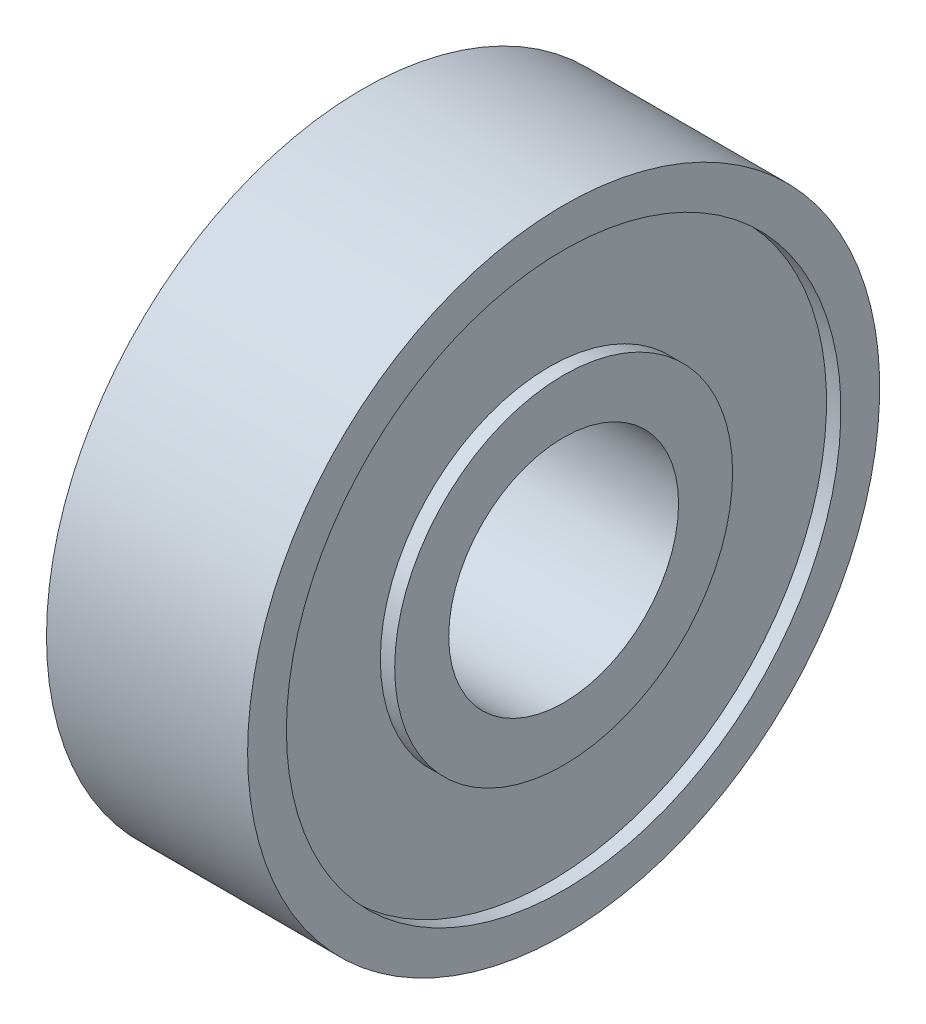
from build123d import *


with BuildPart() as part:
    # Sketch2 → Revolve2 (revolve)
    with BuildSketch(Plane(origin=(0, 0, 0), x_dir=(1, 0, 0), z_dir=(0, 1, 0)), mode=Mode.PRIVATE) as revolve2_sk:
        Polygon((3, 9.65), (3.5, 9.65), (3.5, 11), (-3.5, 11), (-3.5, 9.65), (-3, 9.65), (-3, 5.88), (-3.5, 5.88), (-3.5, 4), (3.5, 4), (3.5, 5.88), (3, 5.88), align=None)
    revolve(revolve2_sk.sketch.rotate(Axis((0, 0, 0), (1, 0, 0)), 180), axis=Axis((0, 0, 0), (1, 0, 0)))


solid = part.part
